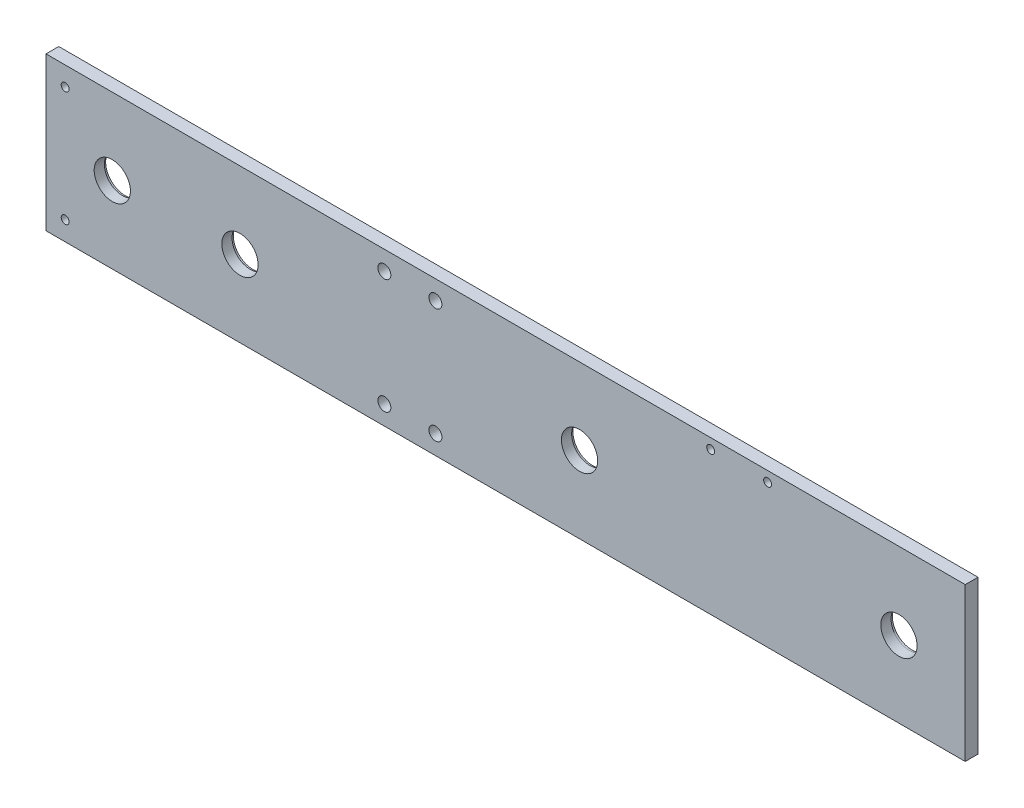
from build123d import *

# Parameters (mm, degrees)
SKETCH1_W           = 360
SKETCH1_H           = 60
SKETCH1_R           = 7.1
SKETCH1_R_2         = 1.55
SKETCH1_R_3         = 2.55
BOSS_EXTRUDE1_DEPTH = 4
SKETCH2_W           = 360
SKETCH2_H           = 60
SKETCH2_R           = 2.55
SKETCH2_R_2         = 1.55
SKETCH2_R_3         = 7.6
BOSS_EXTRUDE2_DEPTH = 1
CUT_EXTRUDE1_START  = -4
SKETCH2_3_R         = 2.55
SKETCH2_3_R_2       = 1.55
CUT_EXTRUDE1_DEPTH  = 4


with BuildPart() as part:
    # Sketch1 → Boss-Extrude1 (new body)
    with BuildSketch(Plane.XY):
        with Locations((154.041275094, 0)):
            Rectangle(SKETCH1_W, SKETCH1_H)
        with Locations((308.082550187, -0.2)):
            Circle(SKETCH1_R, mode=Mode.SUBTRACT)
        with Locations((-18.451377883, 22.492652976)):
            Circle(SKETCH1_R_2, mode=Mode.SUBTRACT)
        Circle(SKETCH1_R, mode=Mode.SUBTRACT)
        with Locations((-18.451377883, -22.492652976)):
            Circle(SKETCH1_R_2, mode=Mode.SUBTRACT)
        with Locations((50, 0)):
            Circle(SKETCH1_R, mode=Mode.SUBTRACT)
        with Locations((183, 0)):
            Circle(SKETCH1_R, mode=Mode.SUBTRACT)
        with Locations((106.548622117, -22.492652976)):
            Circle(SKETCH1_R_3, mode=Mode.SUBTRACT)
        with Locations((106.548622117, 22.492652976)):
            Circle(SKETCH1_R_3, mode=Mode.SUBTRACT)
    extrude(amount=-BOSS_EXTRUDE1_DEPTH)

    # Sketch2 → Boss-Extrude2 (add)
    with BuildSketch(Plane(origin=(0, 0, -4), x_dir=(-1, 0, 0), z_dir=(0, 0, -1))):
        with Locations((-154.041275094, 0)):
            Rectangle(SKETCH2_W, SKETCH2_H)
        with Locations((-126.548622117, -22.492652976)):
            Circle(SKETCH2_R, mode=Mode.SUBTRACT)
        with Locations(Location((-106.548622117, -22.492652976, 0), (0, 0, 180))):
            Circle(SKETCH2_R, mode=Mode.SUBTRACT)
        with Locations(Location((18.451377883, -22.492652976, 0), (0, 0, 180))):
            Circle(SKETCH2_R_2, mode=Mode.SUBTRACT)
        Circle(SKETCH2_R_3, mode=Mode.SUBTRACT)
        with Locations((-308.082550187, 0)):
            Circle(SKETCH2_R_3, mode=Mode.SUBTRACT)
        with Locations((-183, 0)):
            Circle(SKETCH2_R_3, mode=Mode.SUBTRACT)
        with Locations((-256.65, 26)):
            Circle(SKETCH2_R_2, mode=Mode.SUBTRACT)
        with Locations((-234.35, 26)):
            Circle(SKETCH2_R_2, mode=Mode.SUBTRACT)
        with Locations((-50, 0)):
            Circle(SKETCH2_R_3, mode=Mode.SUBTRACT)
        with Locations((-126.548622117, 22.492652976)):
            Circle(SKETCH2_R, mode=Mode.SUBTRACT)
        with Locations(Location((-106.548622117, 22.492652976, 0), (0, 0, 180))):
            Circle(SKETCH2_R, mode=Mode.SUBTRACT)
        with Locations(Location((18.451377883, 22.492652976, 0), (0, 0, 180))):
            Circle(SKETCH2_R_2, mode=Mode.SUBTRACT)
    extrude(amount=BOSS_EXTRUDE2_DEPTH)

    # Sketch2<3> → Cut-Extrude1 (cut)
    with BuildSketch(Plane(origin=(0, 0, -4), x_dir=(-1, 0, 0), z_dir=(0, 0, -1)).offset(CUT_EXTRUDE1_START)):
        with Locations((-126.548622117, 22.492652976)):
            Circle(SKETCH2_3_R)
        with Locations((-126.548622117, -22.492652976)):
            Circle(SKETCH2_3_R)
        with Locations((-256.65, 26)):
            Circle(SKETCH2_3_R_2)
        with Locations((-234.35, 26)):
            Circle(SKETCH2_3_R_2)
    extrude(amount=CUT_EXTRUDE1_DEPTH, mode=Mode.SUBTRACT)


solid = part.part
